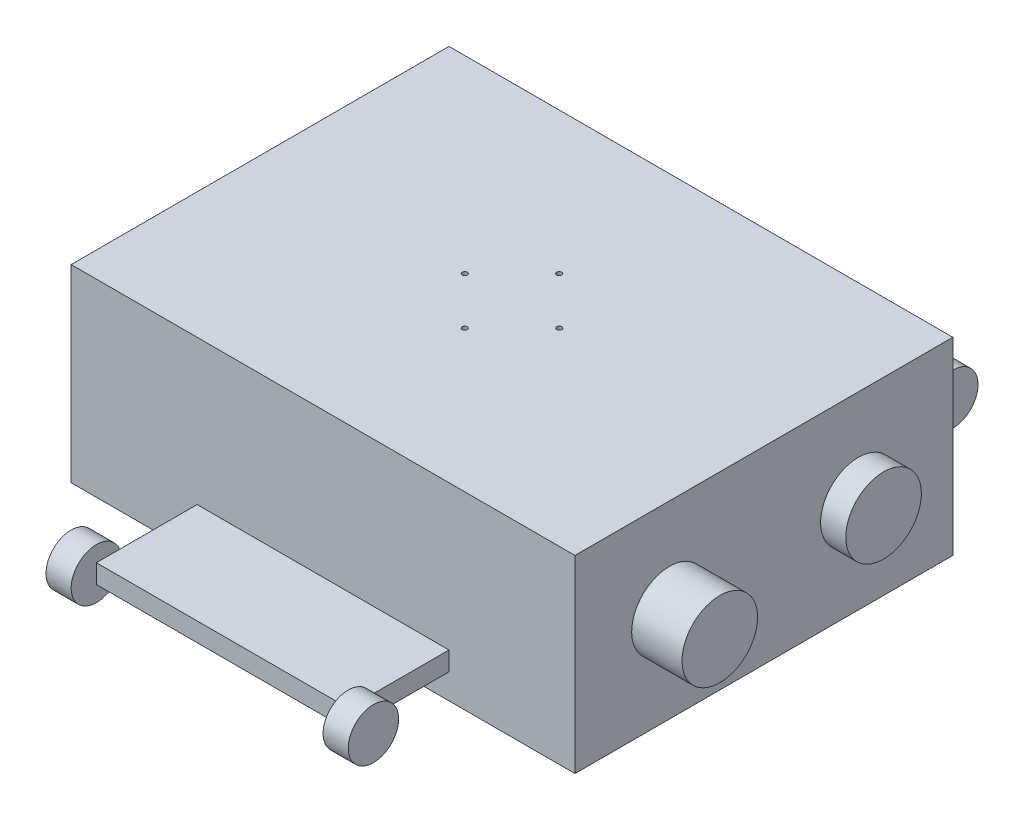
from build123d import *

# Parameters (mm, degrees)
SKETCH_1_W               = 400
SKETCH_1_H               = 150
EXTRUDE_1_DEPTH          = 300
SKETCH_2_R               = 30
EXTRUDE_2_DEPTH          = 20
SKETCH_3_R               = 30
EXTRUDE_3_DEPTH          = 20
EXTRUDE_START            = 20
SKETCH_6_R               = 30
EXTRUDE_4_DEPTH          = 20
SKETCH_7_R               = 30
EXTRUDE_5_DEPTH          = 20
SKETCH_8_W               = 200
SKETCH_8_H               = 15
EXTRUDE_6_DEPTH          = 80
SKETCH_9_R               = 20
EXTRUDE_7_DEPTH          = 20
MIRROR_4_COPY_1_SKETCH_R = 20
MIRROR_4_COPY_1_DEPTH    = 20
SKETCH_10_R              = 2
CUT_EXTRUDE_1_DEPTH      = 10


with BuildPart() as part:
    # 草图1 → 凸台-拉伸1 (new body)
    with BuildSketch(Plane.XY):
        Rectangle(SKETCH_1_W, SKETCH_1_H)
    extrude(amount=-EXTRUDE_1_DEPTH)

    # 草图2 → 凸台-拉伸2 (add)
    with BuildSketch(Plane(origin=(200, 0, 0), x_dir=(0, 0, -1), z_dir=(1, 0, 0))):
        with Locations(Location((75, 0, 0), (0, 0, 90))):
            Circle(SKETCH_2_R)
        with Locations(Location((225, 0, 0), (0, 0, 90))):
            Circle(SKETCH_2_R)
    extrude(amount=EXTRUDE_2_DEPTH)

    # 草图3 → 凸台-拉伸3 (add)
    with BuildSketch(Plane(origin=(220, 0, 0), x_dir=(0, 0, -1), z_dir=(1, 0, 0))):
        with Locations(Location((75, 0, 0), (0, 0, 90))):
            Circle(SKETCH_3_R)
    extrude(amount=EXTRUDE_3_DEPTH)

    # 草图6 → 凸台-拉伸4 (add)
    with BuildSketch(Plane.ZY.offset(200).offset(EXTRUDE_START)):
        with Locations(Location((-225, 0, 0), (0, 0, 90))):
            Circle(SKETCH_6_R)
        with Locations(Location((-75, 0, 0), (0, 0, 90))):
            Circle(SKETCH_6_R)
    extrude(amount=-EXTRUDE_4_DEPTH)

    # 草图7 → 凸台-拉伸5 (add)
    with BuildSketch(Plane.ZY.offset(220).offset(EXTRUDE_START)):
        with Locations(Location((-225, 0, 0), (0, 0, 90))):
            Circle(SKETCH_7_R)
    extrude(amount=-EXTRUDE_5_DEPTH)

    # 草图8 → 凸台-拉伸6 (add)
    with BuildSketch(Plane.XY):
        with Locations((0, -47.5)):
            Rectangle(SKETCH_8_W, SKETCH_8_H)
    extrude_6 = extrude(amount=EXTRUDE_6_DEPTH)

    # 镜向2: 凸台-拉伸6 across plane
    add(extrude_6.mirror(Plane.XY.offset(-150)))

    # 草图9 → 凸台-拉伸7 (add)
    with BuildSketch(Plane(origin=(100, 0, 0), x_dir=(0, 0, -1), z_dir=(1, 0, 0))):
        with Locations(Location((-80, -47.5, 0), (0, 0, 337.975687163))):
            Circle(SKETCH_9_R)
    extrude_7 = extrude(amount=EXTRUDE_7_DEPTH)

    # 镜向3: 凸台-拉伸7 across plane
    add(extrude_7.mirror(Plane.XY.offset(-150)))

    # 镜向4: 凸台-拉伸7 across plane
    add(extrude_7.mirror(Plane(origin=(0, 0, 0), x_dir=(0, 0, 1), z_dir=(1, 0, 0))))

    # 镜向4 copy 1 sketch → 镜向4 copy 1 (add)
    with BuildSketch(Plane(origin=(-100, 0, -300), x_dir=(0, 0, 1), z_dir=(-1, 0, 0))):
        with Locations(Location((-80, -47.5, 0), (0, 0, 337.975687163))):
            Circle(MIRROR_4_COPY_1_SKETCH_R)
    extrude(amount=MIRROR_4_COPY_1_DEPTH)

    # 草图10 → 切除-拉伸1 (cut)
    with BuildSketch(Plane(origin=(0, 75, 0), x_dir=(1, 0, 0), z_dir=(0, 1, 0))):
        with Locations(Location((0, 187.5, 0), (0, 0, 270))):
            Circle(SKETCH_10_R)
        with Locations(Location((37.5, 150, 0), (0, 0, 270))):
            Circle(SKETCH_10_R)
        with Locations(Location((0, 112.5, 0), (0, 0, 270))):
            Circle(SKETCH_10_R)
        with Locations(Location((-37.5, 150, 0), (0, 0, 270))):
            Circle(SKETCH_10_R)
    extrude(amount=-CUT_EXTRUDE_1_DEPTH, mode=Mode.SUBTRACT)


solid = part.part
